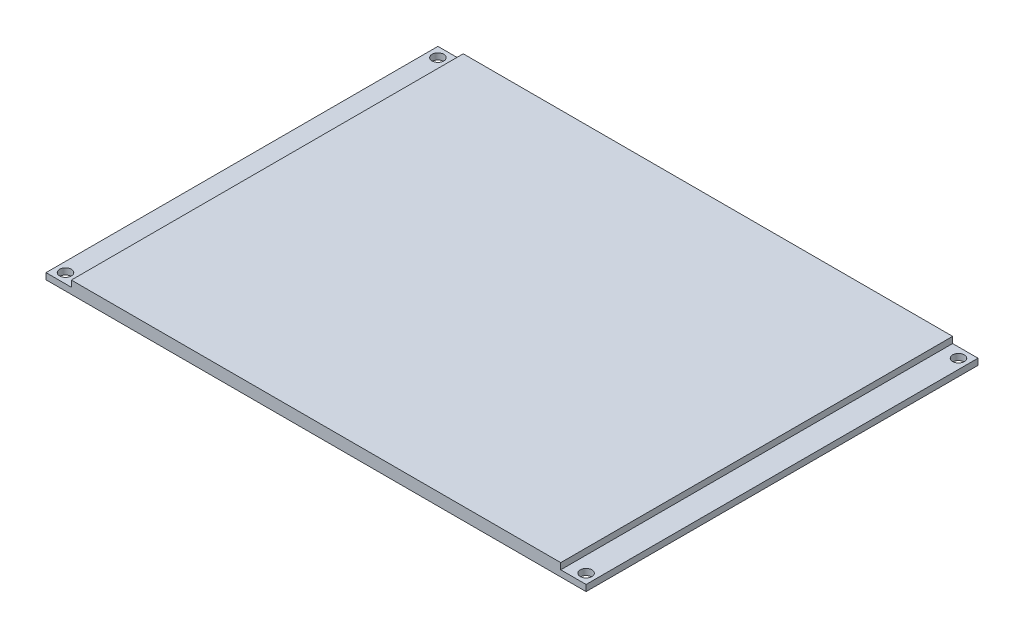
from build123d import *

# Parameters (mm, degrees)
SKETCH1_W           = 138.5
SKETCH1_H           = 100.5
SKETCH1_R           = 1.5
BOSS_EXTRUDE1_DEPTH = 1.6
SKETCH2_W           = 125.5
SKETCH2_H           = 100.5
BOSS_EXTRUDE2_DEPTH = 1.6
SKETCH3_W           = 8
SKETCH3_H           = 20
BOSS_EXTRUDE3_DEPTH = 6


with BuildPart() as part:
    # Sketch1 → Boss-Extrude1 (new body)
    with BuildSketch(Plane(origin=(0, 0, 0), x_dir=(1, 0, 0), z_dir=(0, 1, 0))):
        Rectangle(SKETCH1_W, SKETCH1_H)
        with Locations(Location((-66.75, 47.75, 0), (0, 0, 270))):
            Circle(SKETCH1_R, mode=Mode.SUBTRACT)
        with Locations(Location((66.75, 47.75, 0), (0, 0, 270))):
            Circle(SKETCH1_R, mode=Mode.SUBTRACT)
        with Locations(Location((66.75, -47.75, 0), (0, 0, 270))):
            Circle(SKETCH1_R, mode=Mode.SUBTRACT)
        with Locations(Location((-66.75, -47.75, 0), (0, 0, 270))):
            Circle(SKETCH1_R, mode=Mode.SUBTRACT)
    extrude(amount=BOSS_EXTRUDE1_DEPTH)

    # Sketch2 → Boss-Extrude2 (add)
    with BuildSketch(Plane(origin=(0, 1.6, 0), x_dir=(1, 0, 0), z_dir=(0, 1, 0))):
        Rectangle(SKETCH2_W, SKETCH2_H)
    extrude(amount=BOSS_EXTRUDE2_DEPTH)

    # Sketch3 → Boss-Extrude3 (add)
    with BuildSketch(Plane.XZ):
        with Locations((51.75, 0.25)):
            Rectangle(SKETCH3_W, SKETCH3_H)
    extrude(amount=BOSS_EXTRUDE3_DEPTH)


solid = part.part
